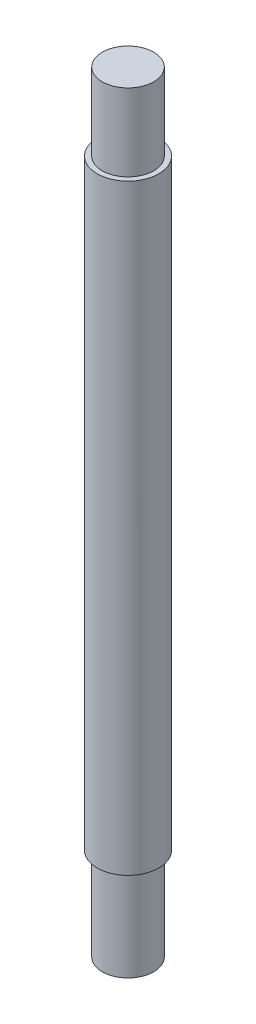
from build123d import *

# Parameters (mm, degrees)
SKETCH_1_R          = 6
EXTRUDE_1_DEPTH     = 150
CUT_EXTRUDE_START   = -15
SKETCH_2_R          = 6
SKETCH_2_R_2        = 5
CUT_EXTRUDE_1_DEPTH = 15
SKETCH_3_R          = 6
SKETCH_3_R_2        = 5
CUT_EXTRUDE_2_DEPTH = 18


with BuildPart() as part:
    # ｽｹｯﾁ1 → ﾎﾞｽ - 押し出し1 (new body)
    with BuildSketch(Plane(origin=(0, 0, 0), x_dir=(1, 0, 0), z_dir=(0, 1, 0))):
        with Locations(Location((0, 0, 0), (0, 0, 270))):
            Circle(SKETCH_1_R)
    extrude(amount=EXTRUDE_1_DEPTH)

    # ｽｹｯﾁ2 → ｶｯﾄ - 押し出し1 (cut)
    with BuildSketch(Plane(origin=(0, 150, 0), x_dir=(1, 0, 0), z_dir=(0, 1, 0)).offset(CUT_EXTRUDE_START)):
        with Locations(Location((0, 0, 0), (0, 0, 270))):
            Circle(SKETCH_2_R)
        with Locations(Location((0, 0, 0), (0, 0, 270))):
            Circle(SKETCH_2_R_2, mode=Mode.SUBTRACT)
    extrude(amount=CUT_EXTRUDE_1_DEPTH, mode=Mode.SUBTRACT)

    # ｽｹｯﾁ3 → ｶｯﾄ - 押し出し2 (cut)
    with BuildSketch(Plane(origin=(0, 0, 0), x_dir=(-1, 0, 0), z_dir=(0, -1, 0))):
        with Locations(Location((0, 0, 0), (0, 0, 90))):
            Circle(SKETCH_3_R)
        with Locations(Location((0, 0, 0), (0, 0, 270))):
            Circle(SKETCH_3_R_2, mode=Mode.SUBTRACT)
    extrude(amount=-CUT_EXTRUDE_2_DEPTH, mode=Mode.SUBTRACT)


solid = part.part
